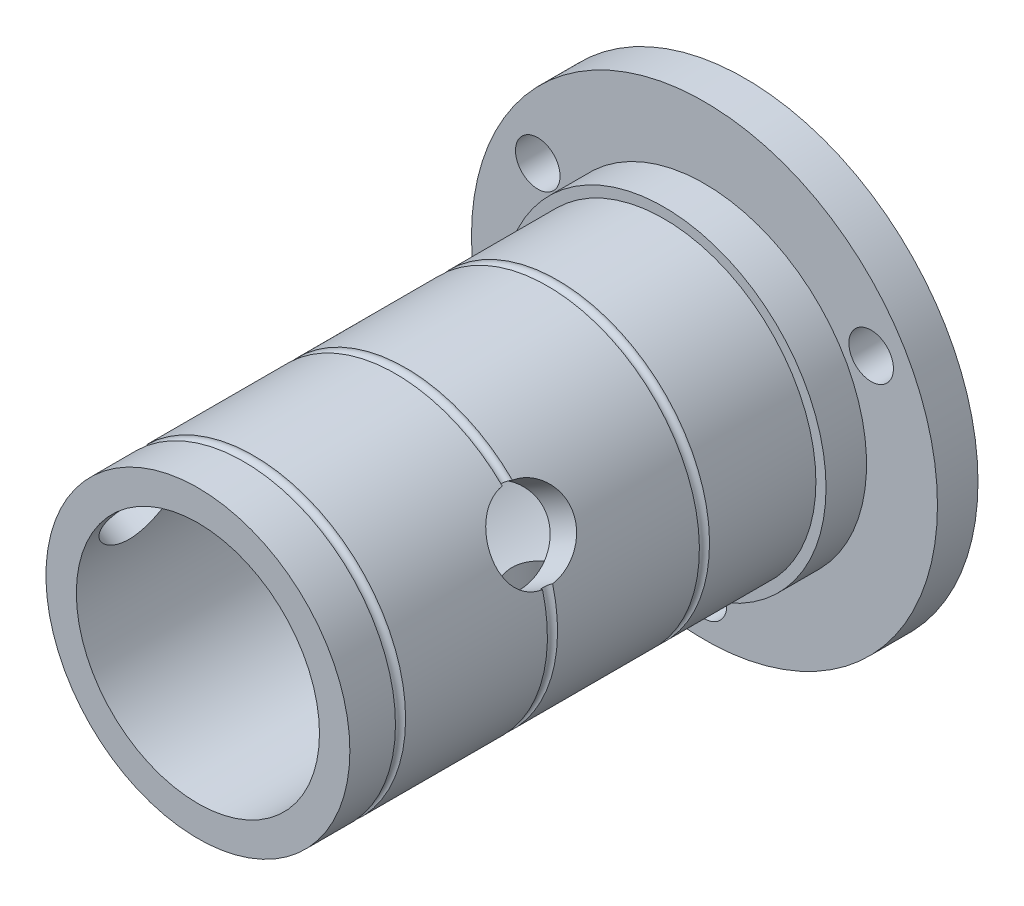
from build123d import *

# Parameters (mm, degrees)
SKETCH_1_R          = 15
SKETCH_1_R_2        = 12
EXTRUDE_1_DEPTH     = 50
SKETCH_2_R          = 23
SKETCH_2_R_2        = 2.2
EXTRUDE_2_DEPTH     = 4
SKETCH_3_R          = 16
EXTRUDE_3_DEPTH     = 4
SKETCH_4_R          = 12
CUT_EXTRUDE_1_DEPTH = 57.338264084
SKETCH_5_R          = 4
CUT_EXTRUDE_2_DEPTH = 60.648973168
SKETCH_6_R          = 4
CUT_EXTRUDE_3_DEPTH = 60.648973252
SKETCH_7_R          = 4
CUT_EXTRUDE_4_DEPTH = 60.648973252
SKETCH_8_R          = 0.5


with BuildPart() as part:
    # 草图1 → 凸台-拉伸1 (new body)
    with BuildSketch(Plane.XY):
        Circle(SKETCH_1_R)
        Circle(SKETCH_1_R_2, mode=Mode.SUBTRACT)
    extrude(amount=EXTRUDE_1_DEPTH)

    # 草图2 → 凸台-拉伸2 (add)
    with BuildSketch(Plane(origin=(0, 0, 0), x_dir=(-1, 0, 0), z_dir=(0, 0, -1))):
        Circle(SKETCH_2_R)
        with Locations((0, -19)):
            Circle(SKETCH_2_R_2, mode=Mode.SUBTRACT)
        with Locations((-16.454482672, 9.5)):
            Circle(SKETCH_2_R_2, mode=Mode.SUBTRACT)
        with Locations((16.454482672, 9.5)):
            Circle(SKETCH_2_R_2, mode=Mode.SUBTRACT)
    extrude(amount=EXTRUDE_2_DEPTH)

    # 草图3 → 凸台-拉伸3 (add)
    with BuildSketch(Plane.XY):
        with Locations(Location((0, 0, 0), (0, 0, 180))):
            Circle(SKETCH_3_R)
    extrude(amount=EXTRUDE_3_DEPTH)

    # 草图4 → 切除-拉伸1 (cut, through all)
    with BuildSketch(Plane.XY.offset(4)):
        Circle(SKETCH_4_R)
    extrude(amount=-CUT_EXTRUDE_1_DEPTH, mode=Mode.SUBTRACT)

    # 草图5 → 切除-拉伸2 (cut, through all)
    with BuildSketch(Plane(origin=(0, 0, 0), x_dir=(1, 0, 0), z_dir=(0, 1, 0))):
        with Locations(Location((0, -15, 0), (0, 0, 270))):
            Circle(SKETCH_5_R)
    extrude(amount=-CUT_EXTRUDE_2_DEPTH, mode=Mode.SUBTRACT)

    # 草图6 → 切除-拉伸3 (cut, through all)
    with BuildSketch(Plane(origin=(0, 0, 0), x_dir=(0, 0, 1), z_dir=(-0.8660254037844364, -0.5000000000000041, 0))):
        with Locations(Location((30, 0, 0), (0, 0, 270))):
            Circle(SKETCH_6_R)
    extrude(amount=-CUT_EXTRUDE_3_DEPTH, mode=Mode.SUBTRACT)

    # 草图7 → 切除-拉伸4 (cut, through all)
    with BuildSketch(Plane(origin=(0, 0, 0), x_dir=(0, 0, 1), z_dir=(0.8660254037844433, -0.49999999999999195, 0))):
        with Locations(Location((45, 0, 0), (0, 0, 270))):
            Circle(SKETCH_7_R)
    extrude(amount=-CUT_EXTRUDE_4_DEPTH, mode=Mode.SUBTRACT)

    # 草图8 → 切除-旋转1 (revolve, cut)
    with BuildSketch(Plane(origin=(0, 0, 0), x_dir=(1, 0, 0), z_dir=(0, 1, 0)), mode=Mode.PRIVATE) as cut_revolve_1_sk:
        with Locations((-15, -15)):
            Circle(SKETCH_8_R)
        with Locations((-15, -30)):
            Circle(SKETCH_8_R)
        with Locations((-15, -45)):
            Circle(SKETCH_8_R)
    revolve(cut_revolve_1_sk.sketch.rotate(Axis((0, 0, -4), (0, 0, 1)), 74.658291446), axis=Axis((0, 0, -4), (0, 0, 1)), mode=Mode.SUBTRACT)


solid = part.part
